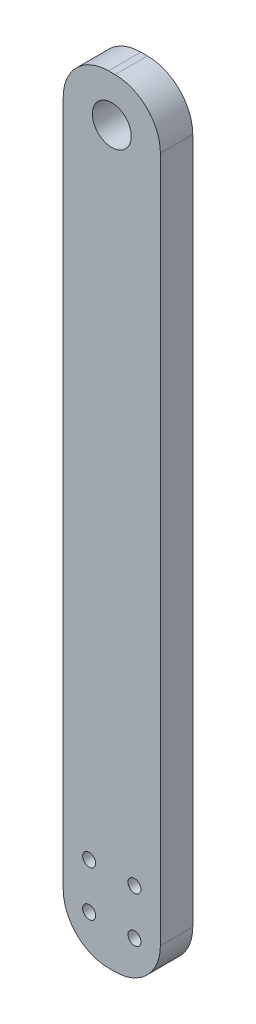
from build123d import *

# Parameters (mm, degrees)
SKETCH1_R             = 1
BOSS_EXTRUDE1_DEPTH   = 5
BOSS_EXTRUDE1_2_DEPTH = 5
BOSS_EXTRUDE1_3_DEPTH = 5
BOSS_EXTRUDE1_4_DEPTH = 5
SKETCH2_R             = 3
BOSS_EXTRUDE2_DEPTH   = 5
SKETCH3_R             = 1
CUT_EXTRUDE2_DEPTH    = 10


with BuildPart() as part:
    # Sketch1 → Boss-Extrude1 (new body)
    with BuildSketch(Plane.XY):
        with Locations((8, 1)):
            Circle(SKETCH1_R)
    extrude(amount=BOSS_EXTRUDE1_DEPTH)



with BuildPart() as body_2:
    # Sketch1 → Boss-Extrude1 2 (new body)
    with BuildSketch(Plane.XY):
        with Locations((8, 8)):
            Circle(SKETCH1_R)
    extrude(amount=BOSS_EXTRUDE1_2_DEPTH)


with BuildPart() as body_3:
    # Sketch1 → Boss-Extrude1 3 (new body)
    with BuildSketch(Plane.XY):
        with Locations((1, 8)):
            Circle(SKETCH1_R)
    extrude(amount=BOSS_EXTRUDE1_3_DEPTH)


with BuildPart() as body_4:
    # Sketch1 → Boss-Extrude1 4 (new body)
    with BuildSketch(Plane.XY):
        with Locations((1, 1)):
            Circle(SKETCH1_R)
    extrude(amount=BOSS_EXTRUDE1_4_DEPTH)


with BuildPart() as part_1:
    add(part.part)

    add(body_2.part)  # Boss-Extrude2 merges body 2

    add(body_3.part)  # Boss-Extrude2 merges body 3

    add(body_4.part)  # Boss-Extrude2 merges body 4
    # Sketch2 → Boss-Extrude2 (add)
    with BuildSketch(Plane.XY.offset(5)):
        with BuildLine():
            Line((4, -5), (5, -5))
            ThreePointArc((5, -5), (9.949747468, -2.949747468), (12, 2))
            Line((12, 2), (12, 108))
            ThreePointArc((12, 108), (9.949747468, 112.949747468), (5, 115))
            Line((5, 115), (4, 115))
            ThreePointArc((4, 115), (-0.949747468, 112.949747468), (-3, 108))
            Line((-3, 108), (-3, 2))
            ThreePointArc((-3, 2), (-0.949747468, -2.949747468), (4, -5))
        make_face()
        with Locations((4.5, 108)):
            Circle(SKETCH2_R, mode=Mode.SUBTRACT)
    extrude(amount=BOSS_EXTRUDE2_DEPTH)

    # Sketch3 → Cut-Extrude2 (cut)
    with BuildSketch(Plane(origin=(0, 0, 0), x_dir=(-1, 0, 0), z_dir=(0, 0, -1))):
        with Locations((-8, 8)):
            Circle(SKETCH3_R)
        with Locations((-1, 8)):
            Circle(SKETCH3_R)
        with Locations((-1, 1)):
            Circle(SKETCH3_R)
        with Locations((-8, 1)):
            Circle(SKETCH3_R)
    extrude(amount=-CUT_EXTRUDE2_DEPTH, mode=Mode.SUBTRACT)


solid = part_1.part
